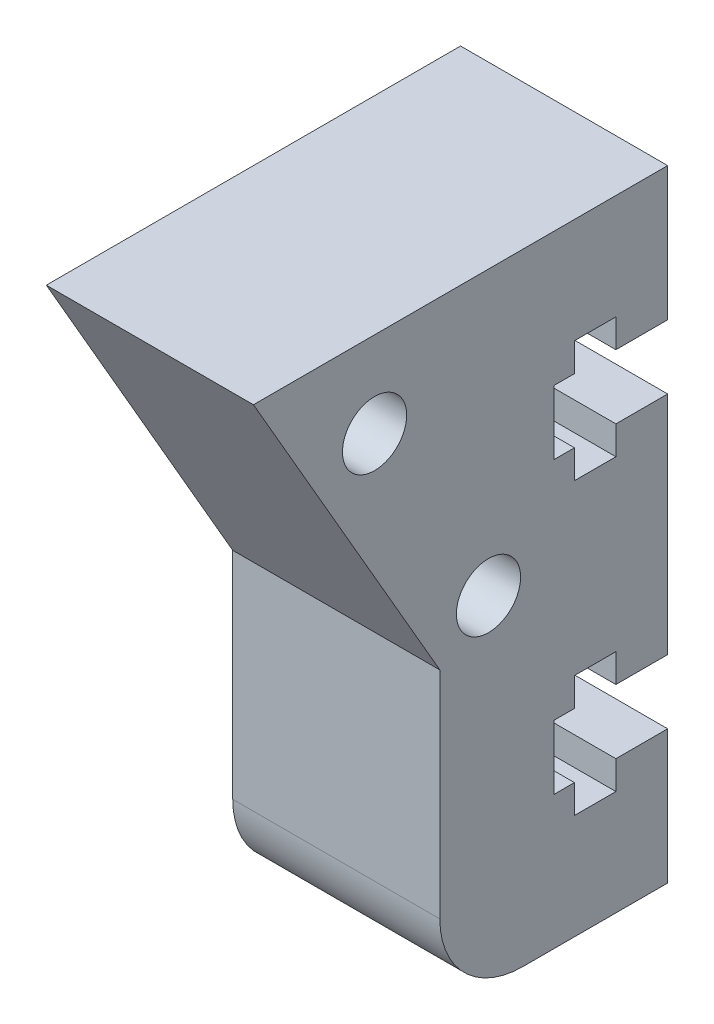
from build123d import *

# Parameters (mm, degrees)
SZKIC1_W                    = 10
SZKIC1_H                    = 30
DODANIE_WYCI_GNI_CIE1_DEPTH = 30
WYTNIJ_WYCI_GNI_CIE1_DEPTH  = 10
SZYK_LINIOWY1_COUNT         = 2
SZYK_LINIOWY1_PITCH         = 14
WYTNIJ_WYCI_GNI_CIE2_DEPTH  = 10
SZKIC7_R                    = 1.55
WYTNIJ_WYCI_GNI_CIE4_DEPTH  = 20
WYTNIJ_WYCI_GNI_CIE5_DEPTH  = 10


with BuildPart() as part:
    # Szkic1 → Dodanie-wyciągnięcie1 (new body)
    with BuildSketch(Plane.XY):
        with Locations((175.434880274, 64.530770571)):
            Rectangle(SZKIC1_W, SZKIC1_H)
    extrude(amount=DODANIE_WYCI_GNI_CIE1_DEPTH)

    # Szkic3 → Wytnij-wyciągnięcie1 (cut)
    with BuildSketch(Plane(origin=(180.434880274, 0, 0), x_dir=(0, 0, -1), z_dir=(1, 0, 0))):
        Polygon((0, 73.080770571), (0, 69.980770571), (-2.5, 69.980770571), (-2.5, 68.605770571), (-4.5, 68.605770571), (-4.5, 69.980770571), (-5.5, 69.980770571), (-5.5, 73.080770571), (-4.5, 73.080770571), (-4.5, 74.455770571), (-2.5, 74.455770571), (-2.5, 73.080770571), align=None)
    wytnij_wyci_gni_cie1 = extrude(amount=-WYTNIJ_WYCI_GNI_CIE1_DEPTH, mode=Mode.SUBTRACT)

    # Szyk liniowy1: Wytnij-wyciągnięcie1 ×2
    with Locations(*[(0, -i * SZYK_LINIOWY1_PITCH, 0) for i in range(1, SZYK_LINIOWY1_COUNT)]):
        add(wytnij_wyci_gni_cie1, mode=Mode.SUBTRACT)

    # Szkic4 → Wytnij-wyciągnięcie2 (cut)
    with BuildSketch(Plane(origin=(180.434880274, 0, 0), x_dir=(0, 0, -1), z_dir=(1, 0, 0))):
        Polygon((-20, 79.530770571), (-11, 63.942313303), (-11, 49.530770571), (-30, 49.530770571), (-30, 79.530770571), align=None)
    extrude(amount=-WYTNIJ_WYCI_GNI_CIE2_DEPTH, mode=Mode.SUBTRACT)

    # Szkic7 → Wytnij-wyciągnięcie4 (cut)
    with BuildSketch(Plane(origin=(180.434880274, 0, 0), x_dir=(0, 0, -1), z_dir=(1, 0, 0))):
        with Locations((-8.651923789, 65.875326005)):
            Circle(SZKIC7_R)
        with Locations((-14.151923789, 75.401605446)):
            Circle(SZKIC7_R)
    extrude(amount=-WYTNIJ_WYCI_GNI_CIE4_DEPTH, mode=Mode.SUBTRACT)

    # Szkic8 → Wytnij-wyciągnięcie5 (cut)
    with BuildSketch(Plane(origin=(180.434880274, 0, 0), x_dir=(0, 0, -1), z_dir=(1, 0, 0))):
        with BuildLine():
            Line((-7, 49.530770571), (-11, 49.530770571))
            Line((-11, 49.530770571), (-11, 53.530770571))
            ThreePointArc((-11, 53.530770571), (-9.828427125, 50.702343446), (-7, 49.530770571))
        make_face()
    extrude(amount=-WYTNIJ_WYCI_GNI_CIE5_DEPTH, mode=Mode.SUBTRACT)


solid = part.part
